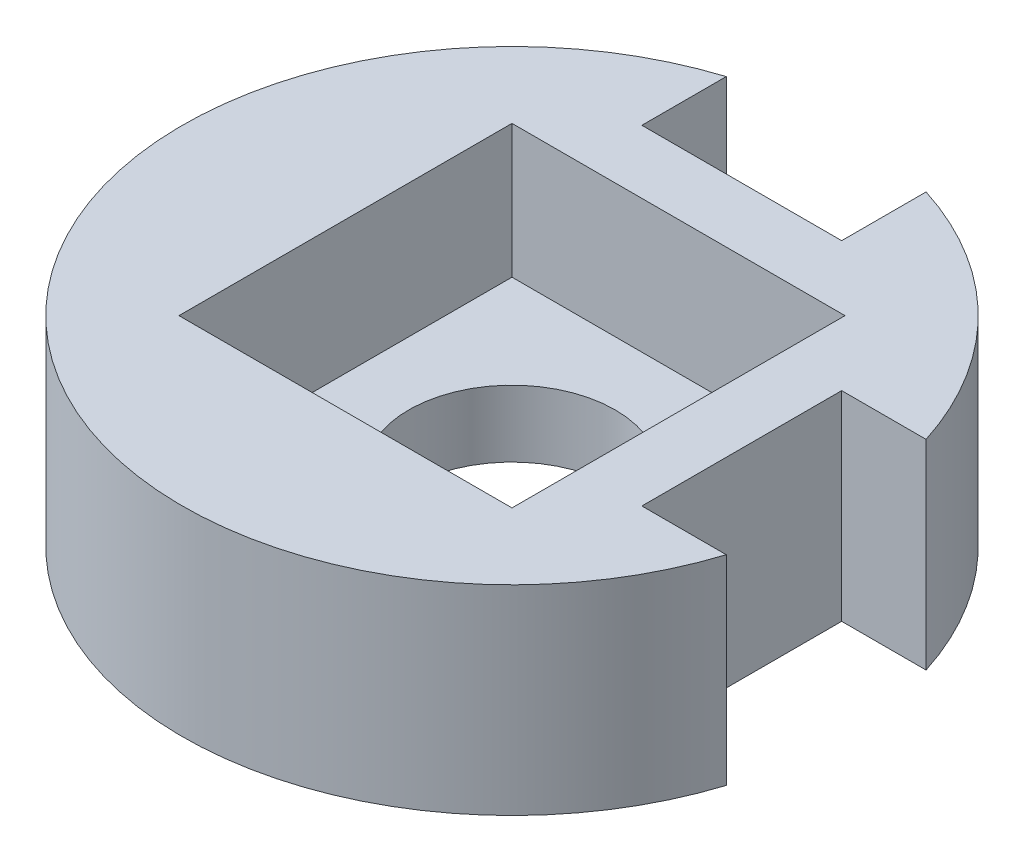
from build123d import *

# Parameters (mm, degrees)
SKETCH1_W           = 10
SKETCH1_H           = 10
BOSS_EXTRUDE1_DEPTH = 6
SKETCH3_W           = 10
SKETCH3_H           = 10
SKETCH3_R           = 3.1
BOSS_EXTRUDE2_DEPTH = 2


with BuildPart() as part:
    # Sketch1 → Boss-Extrude1 (new body)
    with BuildSketch(Plane(origin=(0, 0, 0), x_dir=(1, 0, 0), z_dir=(0, 1, 0))):
        with BuildLine():
            Line((6.9, -3), (6.9, 3))
            Line((6.9, 3), (9.434511116, 3))
            ThreePointArc((9.434511116, 3), (7.000357134, 7.000357134), (3, 9.434511116))
            Line((3, 9.434511116), (3, 6.9))
            Line((3, 6.9), (-3, 6.9))
            Line((-3, 6.9), (-3, 9.434511116))
            ThreePointArc((-3, 9.434511116), (-7.000357134, -7.000357134), (9.434511116, -3))
            Line((9.434511116, -3), (6.9, -3))
        make_face()
        Rectangle(SKETCH1_W, SKETCH1_H, mode=Mode.SUBTRACT)
    extrude(amount=BOSS_EXTRUDE1_DEPTH)

    # Sketch3 → Boss-Extrude2 (add)
    with BuildSketch(Plane.XZ):
        Rectangle(SKETCH3_W, SKETCH3_H)
        with Locations(Location((0, 0, 0), (0, 0, 270))):
            Circle(SKETCH3_R, mode=Mode.SUBTRACT)
    extrude(amount=-BOSS_EXTRUDE2_DEPTH)


solid = part.part
